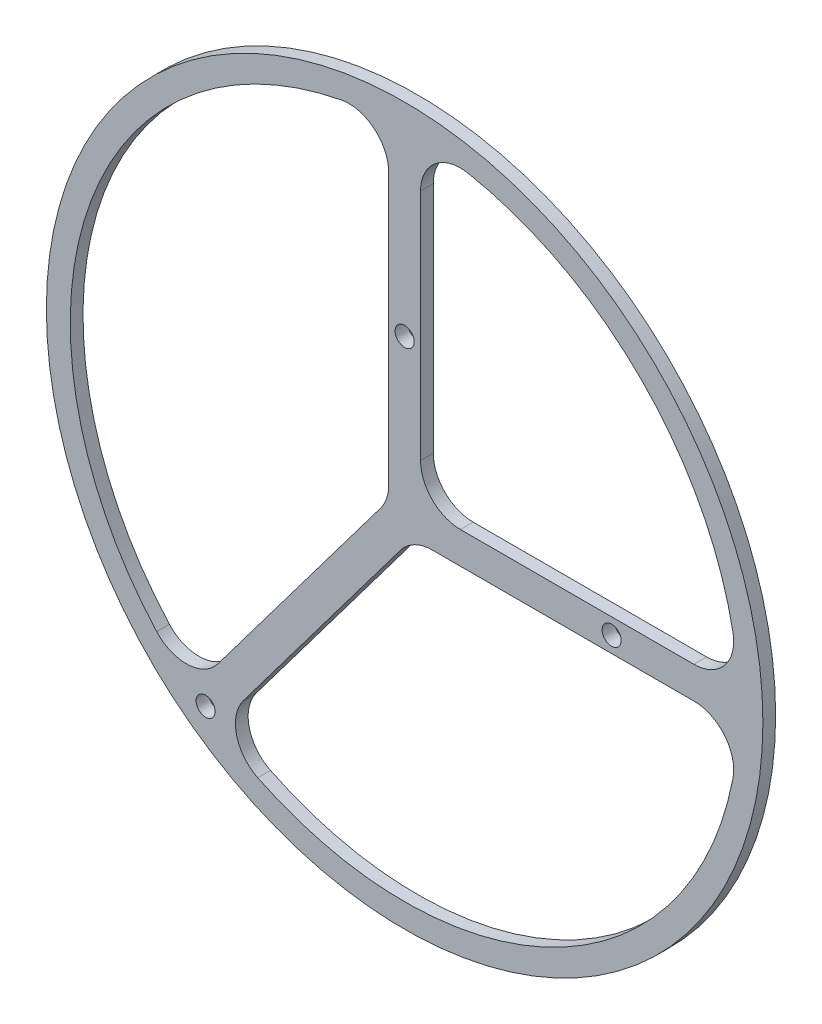
from build123d import *

# Parameters (mm, degrees)
SKETCH5_R                = 45
BOSS_EXTRUDE2_DEPTH      = 1.6
M2_CLEARANCE_HOLE2_D     = 2.4
M2_CLEARANCE_HOLE2_DEPTH = 1.6
M2_CLEARANCE_HOLE2_TIP   = 0.721032743
CUT_EXTRUDE1_DEPTH       = 64.659720389
FILLET1_R                = 5


with BuildPart() as part:
    # Sketch5 → Boss-Extrude2 (new body)
    with BuildSketch(Plane(origin=(0, 0, 0), x_dir=(0, 1, 0), z_dir=(0, 0, 1))):
        with Locations(Location((0, 0, 0), (0, 0, 270))):
            Circle(SKETCH5_R)
    extrude(amount=BOSS_EXTRUDE2_DEPTH)

    # M2 Clearance Hole2
    with Locations(Plane.YX):
        with Locations((-33.221475067, -25), (-42, 26), (0, 26), (19.5, 0)):
            Hole(M2_CLEARANCE_HOLE2_D / 2, depth=M2_CLEARANCE_HOLE2_DEPTH)
            with Locations((0, 0, -(M2_CLEARANCE_HOLE2_DEPTH + M2_CLEARANCE_HOLE2_TIP / 2))):  # 118° drill point
                Cone(0, M2_CLEARANCE_HOLE2_D / 2, M2_CLEARANCE_HOLE2_TIP, mode=Mode.SUBTRACT)

    # Sketch8 → Cut-Extrude1 (cut, through all)
    with BuildSketch(Plane.XY.offset(1.6)):
        with BuildLine():
            Line((-23.401939153, -34.424056262), (-23.627495104, -34.723788317))
            ThreePointArc((-23.627495104, -34.723788317), (18.752644965, -37.58108975), (41.952353927, -2))
            Line((41.952353927, -2), (26, -2))
            Line((26, -2), (0.997983033, -2))
            Line((0.997983033, -2), (-23.401939153, -34.424056262))
        make_face()
        with BuildLine():
            Line((-26.823616798, -32.318625928), (-26.598060847, -32.018893872))
            Line((-26.598060847, -32.018893872), (-2, 0.668460732))
            Line((-2, 0.668460732), (-2, 19.5))
            Line((-2, 19.5), (-2, 41.952353927))
            ThreePointArc((-2, 41.952353927), (-39.833965827, 13.313720987), (-26.823616798, -32.318625928))
        make_face()
        with BuildLine():
            ThreePointArc((41.952353927, 2), (29.69848481, 29.69848481), (2, 41.952353927))
            Line((2, 41.952353927), (2, 19.5))
            Line((2, 19.5), (2, 2))
            Line((2, 2), (26, 2))
            Line((26, 2), (41.952353927, 2))
        make_face()
    extrude(amount=-CUT_EXTRUDE1_DEPTH, mode=Mode.SUBTRACT)

    # Fillet1
    fillet1_edges = [part.edges().sort_by_distance(p)[0] for p in [
        (41.952353927, 2, 0.8),
        (2, 2, 0.8),
        (2, 41.952353927, 0.8),
        (-2, 41.952353927, 0.8),
        (-2, 0.668460732, 0.8),
        (-26.823616798, -32.318625928, 0.8),
        (-23.627495104, -34.723788317, 0.8),
        (0.997983033, -2, 0.8),
        (41.952353927, -2, 0.8),
    ]]
    fillet(fillet1_edges, radius=FILLET1_R)


solid = part.part
